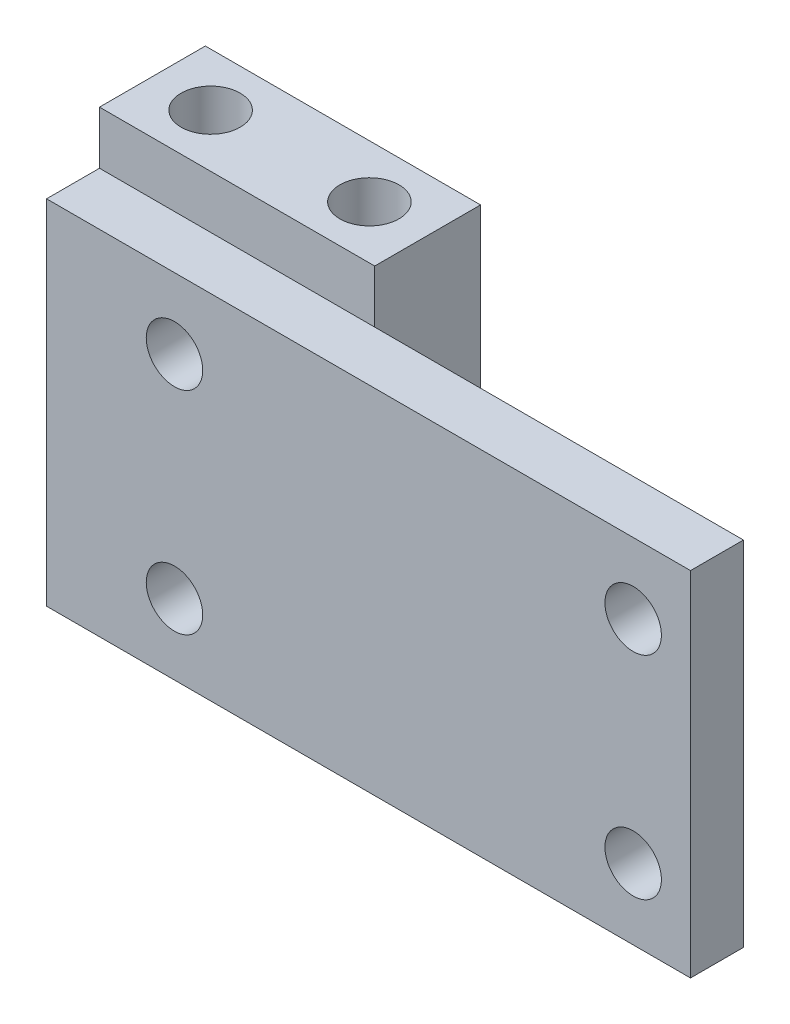
from build123d import *

# Parameters (mm, degrees)
SKETCH1_W                      = 15.6
SKETCH1_H                      = 26
BOSS_EXTRUDE1_DEPTH            = 6
SKETCH2_R                      = 1.675
CUT_EXTRUDE1_DEPTH             = 4.5
CUT_EXTRUDE2_START             = -4.5
SKETCH3_R                      = 1.675
CUT_EXTRUDE2_DEPTH             = 4.5
SKETCH4_W                      = 36.5
SKETCH4_H                      = 20
BOSS_EXTRUDE2_DEPTH            = 3
CBORE_FOR_M3_SHCS4_D           = 3.2
CBORE_FOR_M3_SHCS4_CBORE_D     = 6.6
CBORE_FOR_M3_SHCS4_CBORE_DEPTH = 3


with BuildPart() as part:
    # Sketch1 → Boss-Extrude1 (new body)
    with BuildSketch(Plane.XY):
        with Locations((7.8, 13)):
            Rectangle(SKETCH1_W, SKETCH1_H)
    extrude(amount=BOSS_EXTRUDE1_DEPTH)

    # Sketch2 → Cut-Extrude1 (cut)
    with BuildSketch(Plane(origin=(0, 26, 0), x_dir=(1, 0, 0), z_dir=(0, 1, 0))):
        with Locations(Location((3.3, -3, 0), (0, 0, 270))):
            Circle(SKETCH2_R)
        with Locations(Location((12.3, -3, 0), (0, 0, 270))):
            Circle(SKETCH2_R)
    extrude(amount=-CUT_EXTRUDE1_DEPTH, mode=Mode.SUBTRACT)

    # Sketch3 → Cut-Extrude2 (cut)
    with BuildSketch(Plane.XZ.offset(CUT_EXTRUDE2_START)):
        with Locations(Location((12.3, 3, 0), (0, 0, 90))):
            Circle(SKETCH3_R)
        with Locations(Location((3.3, 3, 0), (0, 0, 90))):
            Circle(SKETCH3_R)
    extrude(amount=CUT_EXTRUDE2_DEPTH, mode=Mode.SUBTRACT)

    # Sketch4 → Boss-Extrude2 (add)
    with BuildSketch(Plane.XY.offset(6)):
        with Locations((18.25, 13)):
            Rectangle(SKETCH4_W, SKETCH4_H)
    extrude(amount=BOSS_EXTRUDE2_DEPTH)

    # CBORE for M3 SHCS4 (through all)
    with Locations(Plane(origin=(0, 0, 0), x_dir=(-1, 0, 0), z_dir=(0, 0, -1))):
        with Locations((-33.25, 19), (-7.25, 19), (-7.25, 7), (-33.25, 7)):
            CounterBoreHole(CBORE_FOR_M3_SHCS4_D / 2, CBORE_FOR_M3_SHCS4_CBORE_D / 2, CBORE_FOR_M3_SHCS4_CBORE_DEPTH)


solid = part.part
